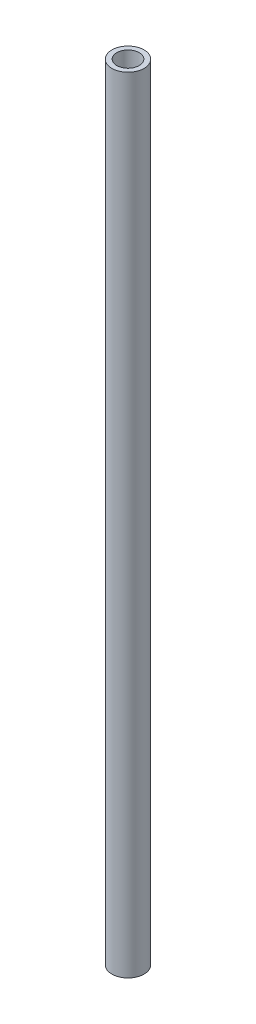
from build123d import *

# Parameters (mm, degrees)
SKETCH1_R           = 0.28702
SKETCH1_R_2         = 0.2
BOSS_EXTRUDE1_DEPTH = 14


with BuildPart() as part:
    # Sketch1 → Boss-Extrude1 (new body)
    with BuildSketch(Plane(origin=(0, 0, 0), x_dir=(1, 0, 0), z_dir=(0, 1, 0))):
        with Locations(Location((0, 0, 0), (0, 0, 270))):
            Circle(SKETCH1_R)
        with Locations(Location((0, 0, 0), (0, 0, 270))):
            Circle(SKETCH1_R_2, mode=Mode.SUBTRACT)
    extrude(amount=BOSS_EXTRUDE1_DEPTH)


solid = part.part
